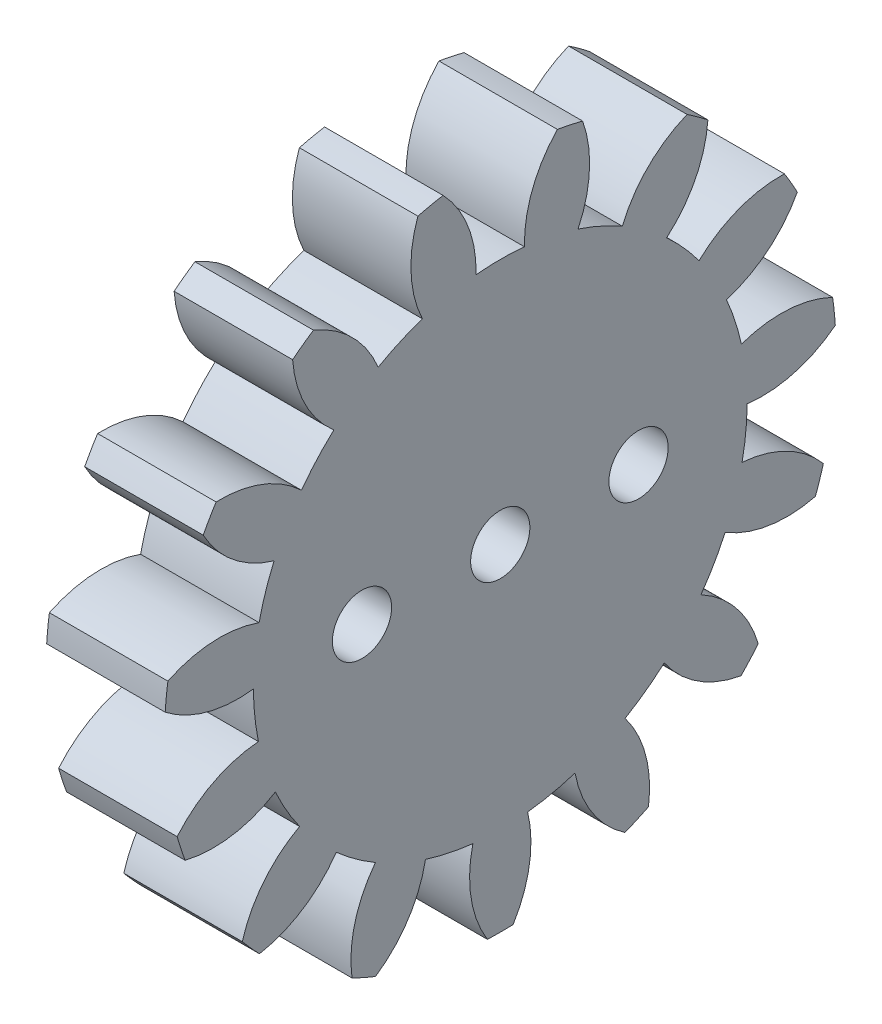
from build123d import *

# Parameters (mm, degrees)
BASPROSKE_W             = 6
BASPROSKE_H             = 17
TOOTHCUT_DEPTH          = 25.779023387
TEETHCUTS_COUNT         = 15
TEETHCUTS_ANGLE         = 336
BORSKE_R                = 4
BORE_DEPTH              = 50.0000508
CROQUIS1_R              = 4
CROQUIS1_R_2            = 1.5
SALIENTE_EXTRUIR1_DEPTH = 6
CROQUIS2_R              = 1.5
CORTAR_EXTRUIR1_DEPTH   = 6


with BuildPart() as part:
    # BasProSke → Base-Revolve (revolve)
    with BuildSketch(Plane(origin=(0, 0, 0), x_dir=(1, 0, 0), z_dir=(0, 1, 0)), mode=Mode.PRIVATE) as base_revolve_sk:
        with Locations((3, 8.5)):
            Rectangle(BASPROSKE_W, BASPROSKE_H)
    revolve(base_revolve_sk.sketch.rotate(Axis((-10, 0, 0), (1, 0, 0)), 180), axis=Axis((-10, 0, 0), (1, 0, 0)))

    # TooCutSke → ToothCut (cut, through all)
    with BuildSketch(Plane(origin=(0, 0, 0), x_dir=(0, 0, -1), z_dir=(1, 0, 0))):
        with BuildLine():
            ThreePointArc((1.225947666, 12.438731982), (0, 12.499), (-1.225947666, 12.438731982))
            ThreePointArc((-1.225947666, 12.438731982), (-1.633372372, 14.776760457), (-2.915451202, 16.773919919))
            ThreePointArc((-2.915451202, 16.773919919), (0, 17.0254), (2.915451202, 16.773919919))
            ThreePointArc((2.915451202, 16.773919919), (1.633372372, 14.776760457), (1.225947666, 12.438731982))
        make_face()
    toothcut = extrude(amount=TOOTHCUT_DEPTH, mode=Mode.SUBTRACT)

    # TeethCuts: ToothCut ×15 about axis
    teethcuts_axis = Axis((-10, 0, 0), (1, 0, 0))
    for i in range(1, TEETHCUTS_COUNT):
        add(toothcut.rotate(teethcuts_axis, i * TEETHCUTS_ANGLE / (TEETHCUTS_COUNT - 1)), mode=Mode.SUBTRACT)

    # BorSke → Bore (cut, symmetric)
    with BuildSketch(Plane(origin=(0, 0, 0), x_dir=(0, 0, -1), z_dir=(1, 0, 0))):
        with Locations(Location((0, 0, 0), (0, 0, 180))):
            Circle(BORSKE_R)
    extrude(amount=BORE_DEPTH, both=True, mode=Mode.SUBTRACT)

    # Croquis1 → Saliente-Extruir1 (add)
    with BuildSketch(Plane(origin=(6, 0, 0), x_dir=(0, 0, -1), z_dir=(1, 0, 0))):
        Circle(CROQUIS1_R)
        Circle(CROQUIS1_R_2, mode=Mode.SUBTRACT)
    extrude(amount=-SALIENTE_EXTRUIR1_DEPTH)

    # Croquis2 → Cortar-Extruir1 (cut)
    with BuildSketch(Plane(origin=(6, 0, 0), x_dir=(0, 0, -1), z_dir=(1, 0, 0))):
        with Locations((-7, 0)):
            Circle(CROQUIS2_R)
        with Locations((7, 0)):
            Circle(CROQUIS2_R)
    extrude(amount=-CORTAR_EXTRUIR1_DEPTH, mode=Mode.SUBTRACT)


solid = part.part
